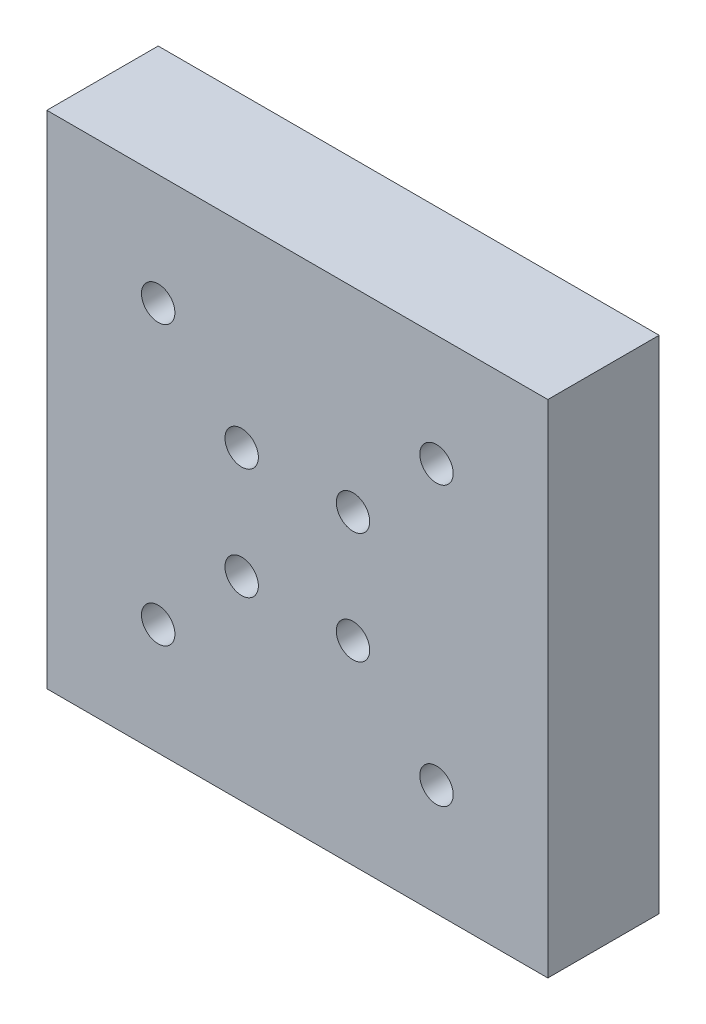
from build123d import *

# Parameters (mm, degrees)
SKETCH1_W           = 45
SKETCH1_H           = 45
BOSS_EXTRUDE1_DEPTH = 10
SKETCH2_R           = 1.5
CUT_EXTRUDE1_DEPTH  = 10
SKETCH3_R           = 1.5
CUT_EXTRUDE2_DEPTH  = 10


with BuildPart() as part:
    # Sketch1 → Boss-Extrude1 (new body)
    with BuildSketch(Plane.XY):
        Rectangle(SKETCH1_W, SKETCH1_H)
    extrude(amount=BOSS_EXTRUDE1_DEPTH)

    # Sketch2 → Cut-Extrude1 (cut)
    with BuildSketch(Plane.XY.offset(10)):
        with Locations((-12.5, 12.5)):
            Circle(SKETCH2_R)
        with Locations((12.5, 12.5)):
            Circle(SKETCH2_R)
        with Locations((12.5, -12.5)):
            Circle(SKETCH2_R)
        with Locations((-12.5, -12.5)):
            Circle(SKETCH2_R)
    extrude(amount=-CUT_EXTRUDE1_DEPTH, mode=Mode.SUBTRACT)

    # Sketch3 → Cut-Extrude2 (cut)
    with BuildSketch(Plane.XY.offset(10)):
        with Locations((-5, 5)):
            Circle(SKETCH3_R)
        with Locations((5, 5)):
            Circle(SKETCH3_R)
        with Locations((5, -5)):
            Circle(SKETCH3_R)
        with Locations((-5, -5)):
            Circle(SKETCH3_R)
    extrude(amount=-CUT_EXTRUDE2_DEPTH, mode=Mode.SUBTRACT)


solid = part.part
